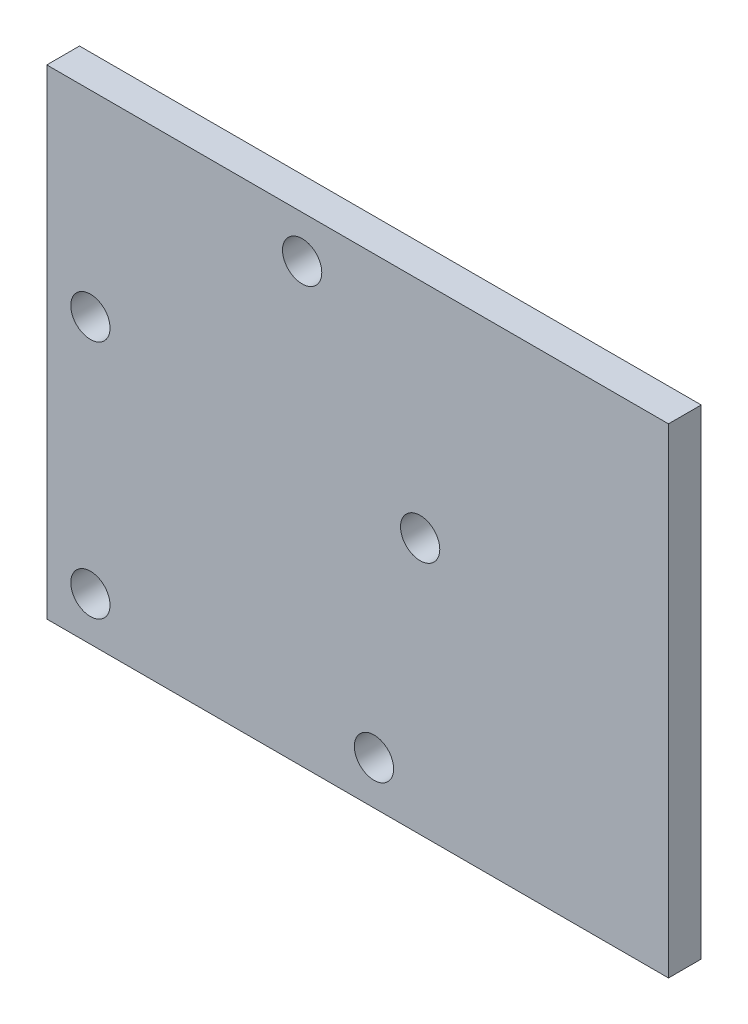
from build123d import *

# Parameters (mm, degrees)
SKETCH1_W           = 57
SKETCH1_H           = 44
SKETCH1_R           = 1.8
BOSS_EXTRUDE1_DEPTH = 3


with BuildPart() as part:
    # Sketch1 → Boss-Extrude1 (new body)
    with BuildSketch(Plane.XY):
        with Locations((28.5, 22)):
            Rectangle(SKETCH1_W, SKETCH1_H)
        with Locations((4, 4)):
            Circle(SKETCH1_R, mode=Mode.SUBTRACT)
        with Locations((30, 4)):
            Circle(SKETCH1_R, mode=Mode.SUBTRACT)
        with Locations((4, 26)):
            Circle(SKETCH1_R, mode=Mode.SUBTRACT)
        with Locations((23.411472602, 40.113636364)):
            Circle(SKETCH1_R, mode=Mode.SUBTRACT)
        with Locations((34.230769231, 23.547393476)):
            Circle(SKETCH1_R, mode=Mode.SUBTRACT)
    extrude(amount=BOSS_EXTRUDE1_DEPTH)


solid = part.part
